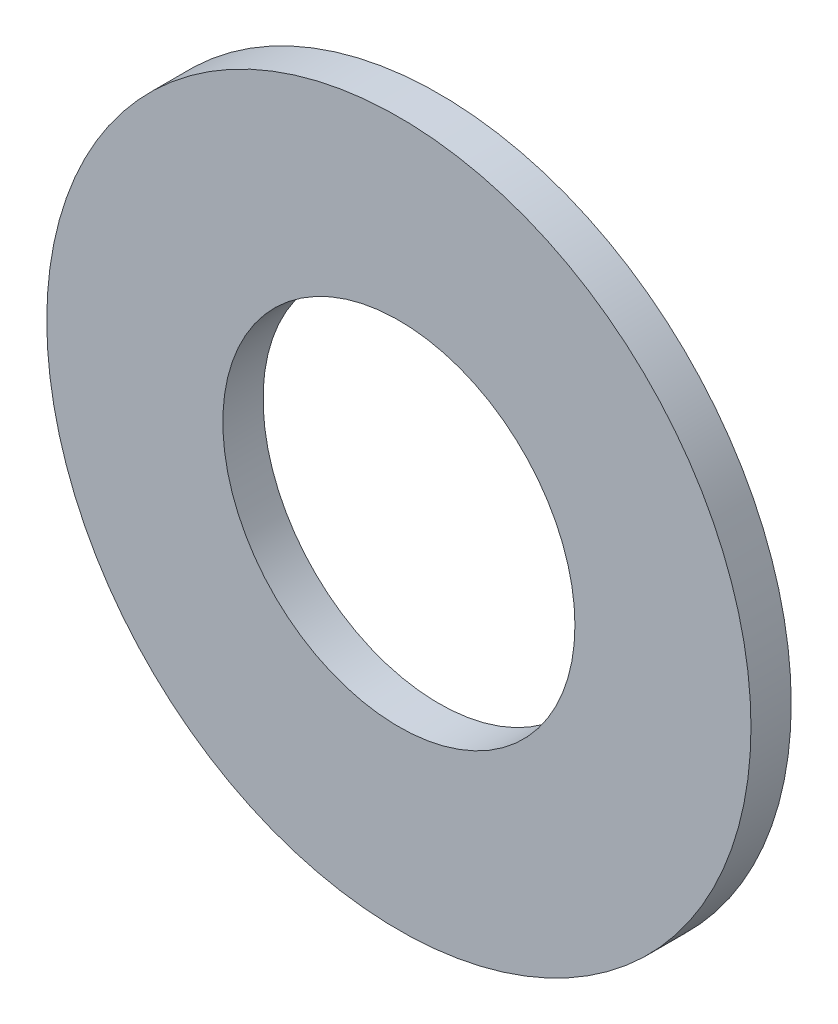
from build123d import *

# Parameters (mm, degrees)
SKETCH1_R           = 3.5
SKETCH1_R_2         = 1.75
BOSS_EXTRUDE1_DEPTH = 0.4


with BuildPart() as part:
    # Sketch1 → Boss-Extrude1 (new body)
    with BuildSketch(Plane.XY):
        Circle(SKETCH1_R)
        Circle(SKETCH1_R_2, mode=Mode.SUBTRACT)
    extrude(amount=BOSS_EXTRUDE1_DEPTH)


solid = part.part
